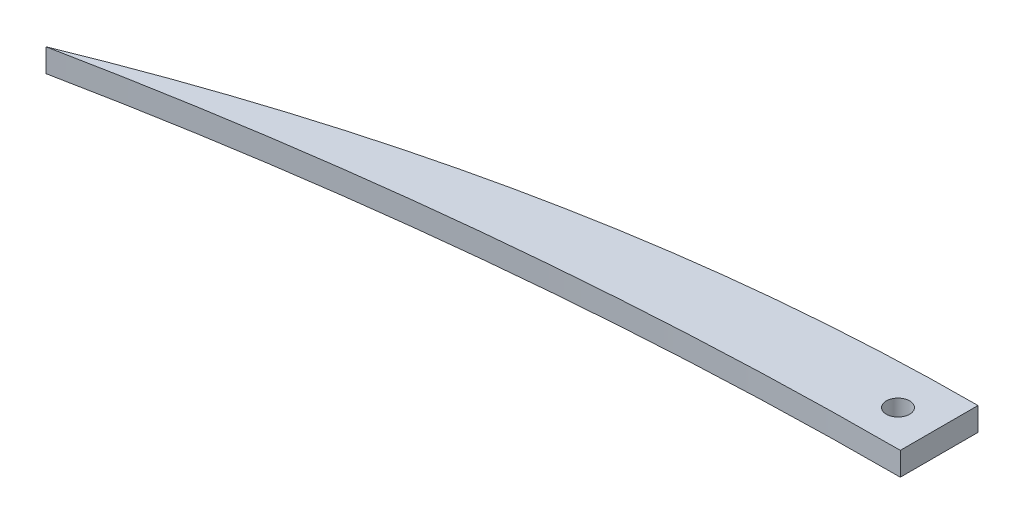
from build123d import *

# Parameters (mm, degrees)
BOSS_EXTRUDE1_DEPTH = 3
SKETCH2_R           = 1.5
CUT_EXTRUDE1_DEPTH  = 3


with BuildPart() as part:
    # Sketch1 → Boss-Extrude1 (new body)
    with BuildSketch(Plane(origin=(0, 0, 0), x_dir=(1, 0, 0), z_dir=(0, 1, 0))):
        with BuildLine():
            add(Edge.make_bspline(
                [(0, 0), (49.009804864, 20), (100, 20)],
                knots=[0, 0, 0, 1, 1, 1], degree=2))
            add(Edge.make_bspline(
                [(0, 0), (49.750621894, 10), (100, 10)],
                knots=[0, 0, 0, 1, 1, 1], degree=2))
            Line((100, 10), (100, 20))
        make_face()
    extrude(amount=BOSS_EXTRUDE1_DEPTH)

    # Sketch2 → Cut-Extrude1 (cut)
    with BuildSketch(Plane(origin=(0, 3, 0), x_dir=(1, 0, 0), z_dir=(0, 1, 0))):
        with Locations(Location((95.080291249, 14.617484051, 0), (0, 0, 270))):
            Circle(SKETCH2_R)
    extrude(amount=-CUT_EXTRUDE1_DEPTH, mode=Mode.SUBTRACT)


solid = part.part
